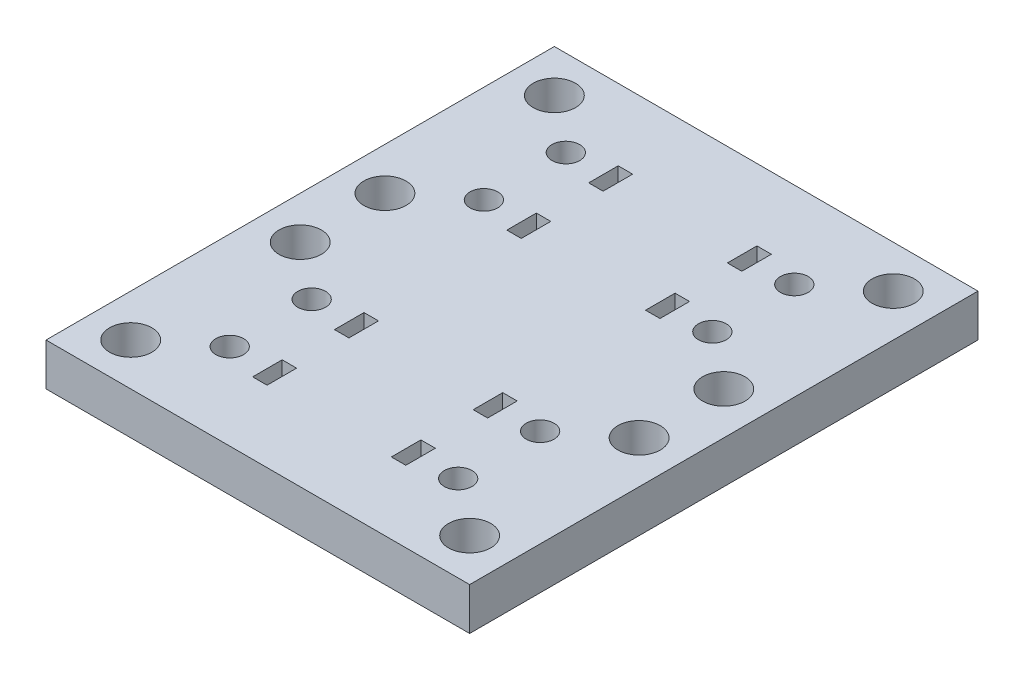
from build123d import *

# Parameters (mm, degrees)
SKETCH1_W           = 127
SKETCH1_H           = 76.2
SKETCH1_R           = 8.33021032
SKETCH1_R_2         = 12.7
SKETCH1_W_2         = 8.659801889
SKETCH1_H_2         = 17.712025184
BOSS_EXTRUDE1_DEPTH = 25.4


with BuildPart() as part:
    # Sketch1 → Boss-Extrude1 (new body)
    with BuildSketch(Plane(origin=(0, 0, 0), x_dir=(1, 0, 0), z_dir=(0, 1, 0))):
        with Locations((63.5, 38.1)):
            Rectangle(SKETCH1_W, SKETCH1_H)
        with Locations(Location((68.491601229, 24.568808003, 0), (0, 0, 270))):
            Circle(SKETCH1_R, mode=Mode.SUBTRACT)
        with Locations(Location((101.6, 50.8, 0), (0, 0, 270))):
            Circle(SKETCH1_R_2, mode=Mode.SUBTRACT)
        with Locations((41.585480672, 24.535685835)):
            Rectangle(SKETCH1_W_2, SKETCH1_H_2, mode=Mode.SUBTRACT)
    extrude(amount=BOSS_EXTRUDE1_DEPTH)

    # Mirror1: part across plane


with BuildPart() as part_1:
    add(part.part)
    add(part.part.mirror(Plane(origin=(0, 25.4, 0), x_dir=(0, 0, 1), z_dir=(1, 0, 0))))

    # Mirror2: part across plane


with BuildPart() as part_2:
    add(part_1.part)
    add(part_1.part.mirror(Plane(origin=(0, 25.4, 0), x_dir=(1, 0, 0), z_dir=(0, 0, -1))))

    # Mirror3: part across face


with BuildPart() as part_3:
    add(part_2.part)
    add(part_2.part.mirror(Plane(origin=(0, 12.7, 76.2), x_dir=(1, 0, 0), z_dir=(0, 0, 1))))


solid = part_3.part
